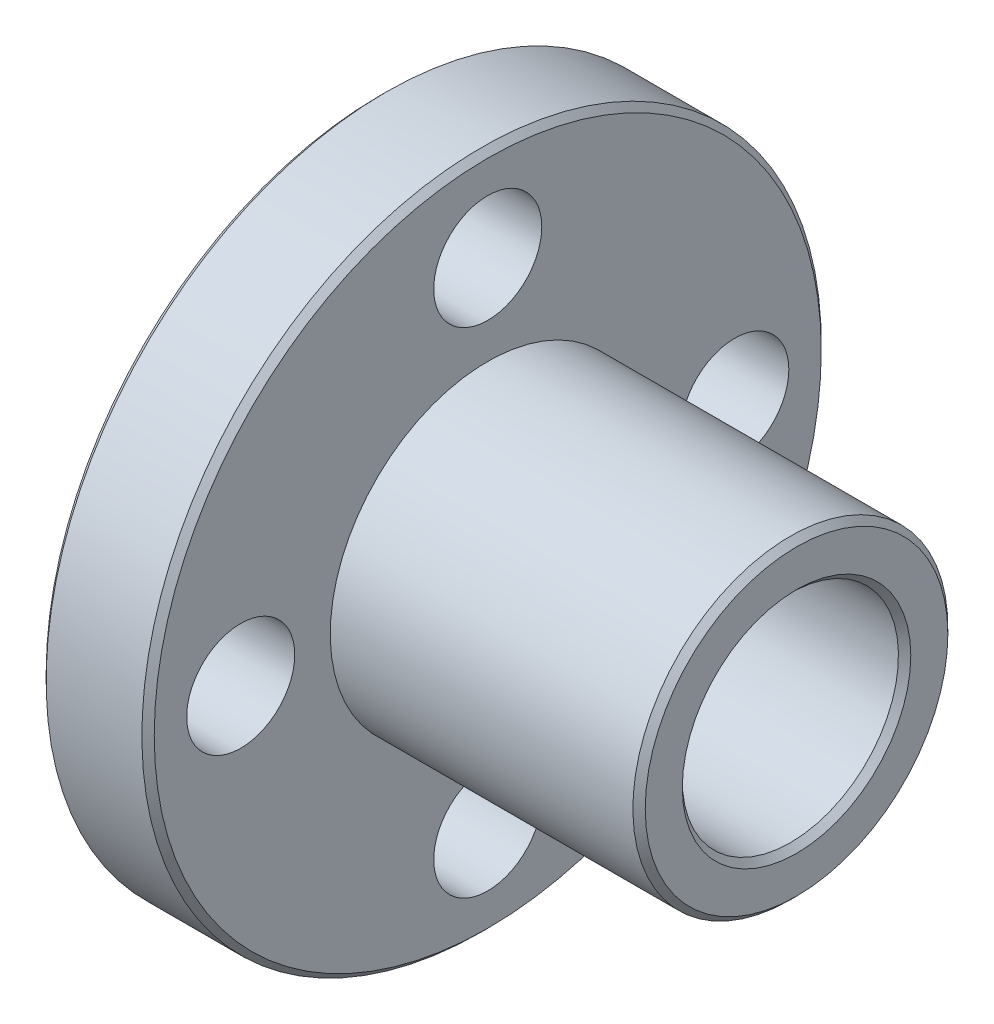
from build123d import *

# Parameters (mm, degrees)
CHAMFER1_SIZE     = 0.2
CIRPATTERN1_COUNT = 4


with BuildPart() as part:
    # Sketch1 → Revolve1 (revolve)
    with BuildSketch(Plane.XY, mode=Mode.PRIVATE) as revolve1_sk:
        Polygon((0, 5.1), (0, 11), (3.5, 11), (3.5, 5.1), (13.5, 5.1), (13.5, 3.5), (-1.5, 3.5), (-1.5, 5.1), align=None)
    revolve(revolve1_sk.sketch.rotate(Axis((0, 0, 0), (1, 0, 0)), 180), axis=Axis((0, 0, 0), (1, 0, 0)))

    # Chamfer1
    chamfer1_edges = [part.edges().sort_by_distance(p)[0] for p in [
        (-1.5, 3.5, 0),
        (13.5, 3.5, 0),
        (13.5, 5.1, 0),
        (3.5, 11, 0),
        (0, 11, 0),
        (-1.5, 5.1, 0),
    ]]
    chamfer(chamfer1_edges, length=CHAMFER1_SIZE)

    # Sketch5 → M3 Clearance Hole1 (revolve, cut)
    with BuildSketch(Plane(origin=(3.5, 8, 0), x_dir=(0, 0, -1), z_dir=(0, 1, 0))):
        Polygon((0, 0), (0, 4.051506083), (1.75, 3), (1.75, 0), align=None)
    m3_clearance_hole1 = revolve(axis=Axis((9.85, 8, 0), (-1, 0, 0)), mode=Mode.SUBTRACT)

    # CirPattern1: M3 Clearance Hole1 ×4 about axis
    cirpattern1_axis = Axis((0, 0, 0), (1, 0, 0))
    for i in range(1, CIRPATTERN1_COUNT):
        add(m3_clearance_hole1.rotate(cirpattern1_axis, i * 360 / CIRPATTERN1_COUNT), mode=Mode.SUBTRACT)


solid = part.part
